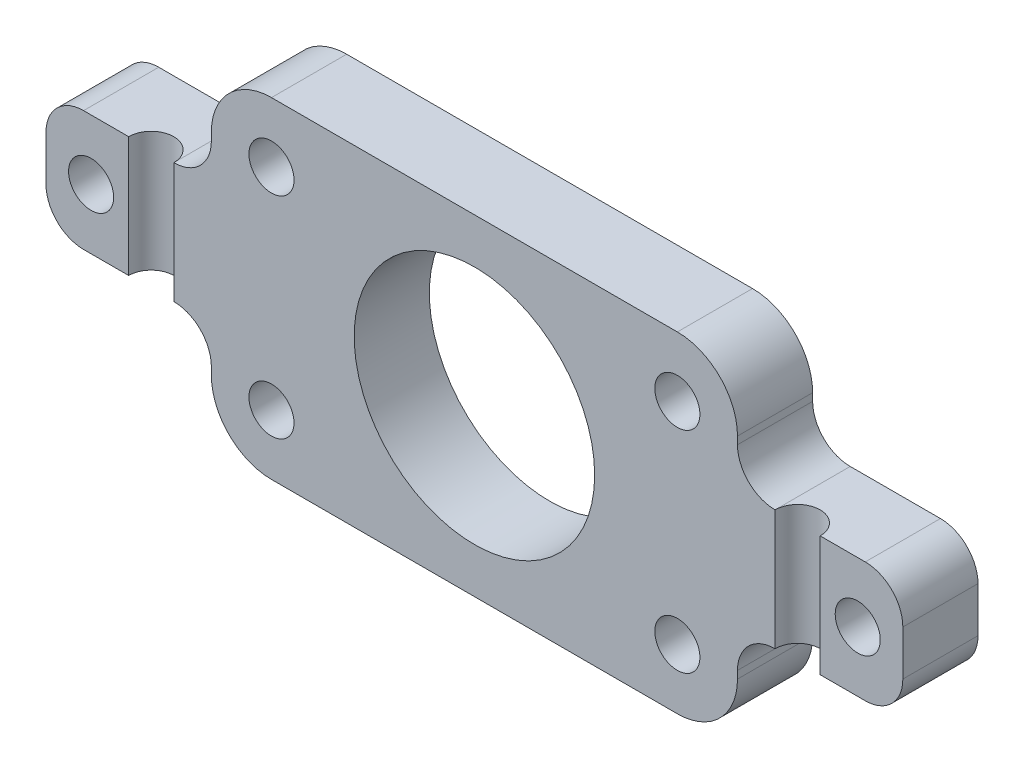
from build123d import *

# Parameters (mm, degrees)
SKETCH_1_R          = 8
SKETCH_1_R_2        = 1.5
EXTRUDE_1_DEPTH     = 5
SKETCH_2_R          = 1.5
CUT_EXTRUDE_1_DEPTH = 11.5
CHAMFER_1_SIZE      = 2


with BuildPart() as part:
    # 草图1 → 凸台-拉伸1 (new body)
    with BuildSketch(Plane.XY):
        with BuildLine():
            Line((2.5, 15), (8.5, 15))
            ThreePointArc((8.5, 15), (10.267766953, 15.732233047), (11, 17.5))
            Line((11, 17.5), (11, 18))
            ThreePointArc((11, 18), (12.171572875, 20.828427125), (15, 22))
            Line((15, 22), (42, 22))
            ThreePointArc((42, 22), (44.828427125, 20.828427125), (46, 18))
            Line((46, 18), (46, 17.5))
            ThreePointArc((46, 17.5), (46.732233047, 15.732233047), (48.5, 15))
            Line((48.5, 15), (54.5, 15))
            ThreePointArc((54.5, 15), (56.267766953, 14.267766953), (57, 12.5))
            Line((57, 12.5), (57, 9.5))
            ThreePointArc((57, 9.5), (56.267766953, 7.732233047), (54.5, 7))
            Line((54.5, 7), (48.5, 7))
            ThreePointArc((48.5, 7), (46.732233047, 6.267766953), (46, 4.5))
            Line((46, 4.5), (46, 4))
            ThreePointArc((46, 4), (44.828427125, 1.171572875), (42, 0))
            Line((42, 0), (15, 0))
            ThreePointArc((15, 0), (12.171572875, 1.171572875), (11, 4))
            Line((11, 4), (11, 4.5))
            ThreePointArc((11, 4.5), (10.267766953, 6.267766953), (8.5, 7))
            Line((8.5, 7), (2.5, 7))
            ThreePointArc((2.5, 7), (0.732233047, 7.732233047), (0, 9.5))
            Line((0, 9.5), (0, 12.5))
            ThreePointArc((0, 12.5), (0.732233047, 14.267766953), (2.5, 15))
        make_face()
        with Locations((28.5, 11)):
            Circle(SKETCH_1_R, mode=Mode.SUBTRACT)
        with Locations((15, 18)):
            Circle(SKETCH_1_R_2, mode=Mode.SUBTRACT)
        with Locations(Location((15, 4, 0), (0, 0, 180))):
            Circle(SKETCH_1_R_2, mode=Mode.SUBTRACT)
        with Locations(Location((42, 18, 0), (0, 0, 180))):
            Circle(SKETCH_1_R_2, mode=Mode.SUBTRACT)
        with Locations((42, 4)):
            Circle(SKETCH_1_R_2, mode=Mode.SUBTRACT)
        with Locations((3, 11)):
            Circle(SKETCH_1_R_2, mode=Mode.SUBTRACT)
        with Locations(Location((54, 11, 0), (0, 0, 180))):
            Circle(SKETCH_1_R_2, mode=Mode.SUBTRACT)
    extrude(amount=EXTRUDE_1_DEPTH)

    # 草图2 → 切除-拉伸1 (cut)
    with BuildSketch(Plane(origin=(0, 15, 0), x_dir=(1, 0, 0), z_dir=(0, 1, 0))):
        with Locations((7, -5)):
            Circle(SKETCH_2_R)
        with Locations((50, -5)):
            Circle(SKETCH_2_R)
    extrude(amount=-CUT_EXTRUDE_1_DEPTH, mode=Mode.SUBTRACT)

    # 倒角1
    chamfer_1_edges = [part.edges().sort_by_distance(p)[0] for p in [
        (13.5, 18, 0),
        (16.5, 4, 0),
        (43.5, 18, 0),
        (40.5, 4, 0),
    ]]
    chamfer(chamfer_1_edges, length=CHAMFER_1_SIZE)


solid = part.part
